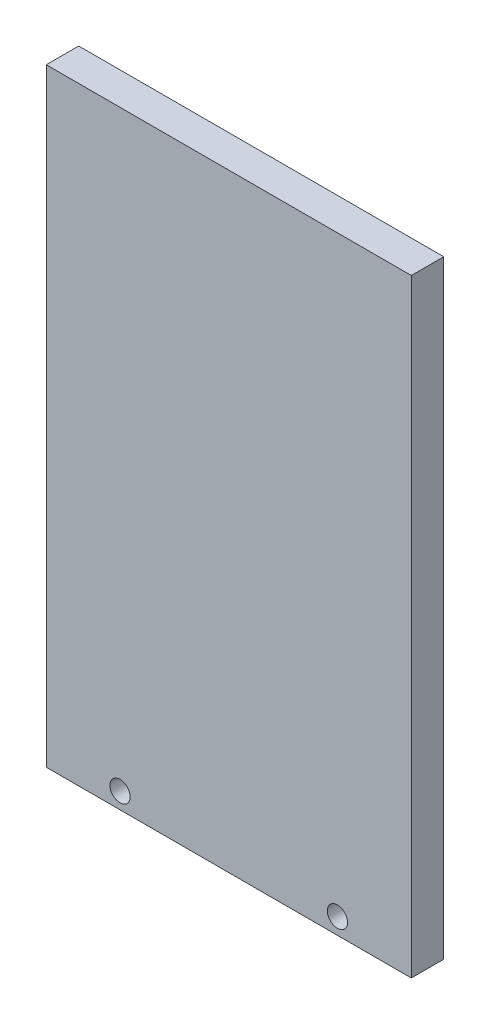
from build123d import *

# Parameters (mm, degrees)
CROQUIS1_W              = 45
CROQUIS1_H              = 75
CROQUIS1_R              = 1.25
SALIENTE_EXTRUIR1_DEPTH = 4


with BuildPart() as part:
    # Croquis1 → Saliente-Extruir1 (new body)
    with BuildSketch(Plane.XY):
        with Locations((7.5, -13.156453444)):
            Rectangle(CROQUIS1_W, CROQUIS1_H)
        with Locations((-5.9, -48.656453444)):
            Circle(CROQUIS1_R, mode=Mode.SUBTRACT)
        with Locations(Location((20.9, -48.656453444, 0), (0, 0, 180))):
            Circle(CROQUIS1_R, mode=Mode.SUBTRACT)
    extrude(amount=SALIENTE_EXTRUIR1_DEPTH)


solid = part.part
